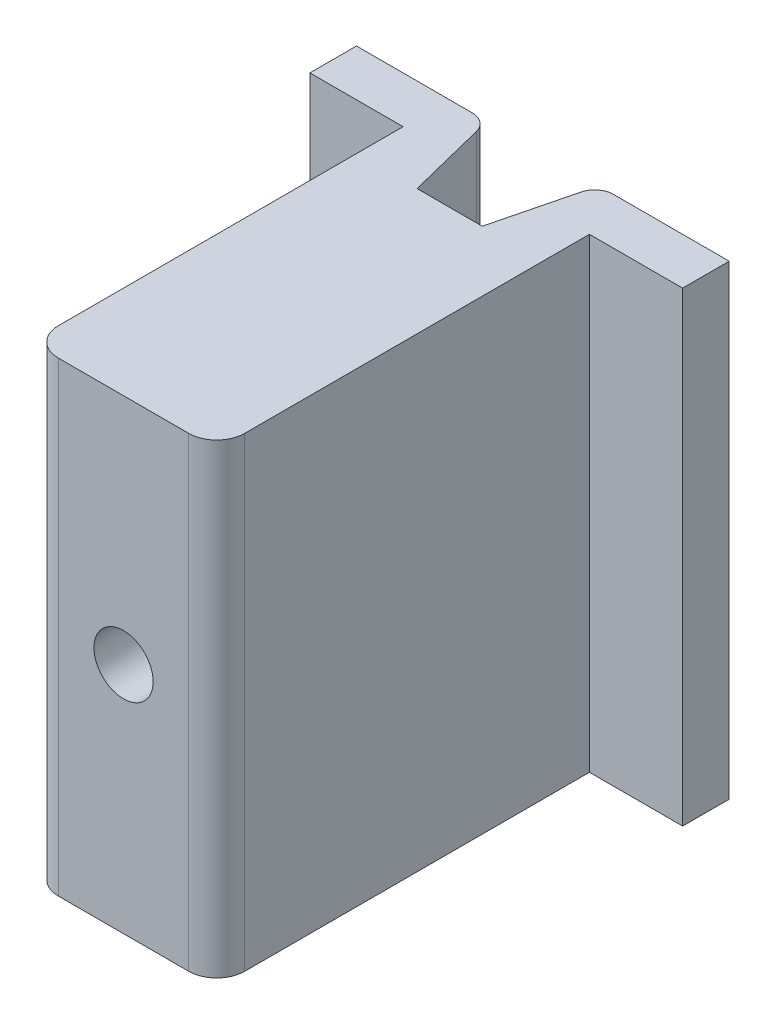
from build123d import *

# Parameters (mm, degrees)
CROQUIS1_W              = 40
CROQUIS1_H              = 50
SALIENTE_EXTRUIR1_DEPTH = 5
CROQUIS2_W              = 20
CROQUIS2_H              = 50
SALIENTE_EXTRUIR2_DEPTH = 40
CORTAR_EXTRUIR1_REACH   = 72.178
REDONDEO1_R             = 2
CORTAR_EXTRUIR2_REACH   = 57.227
CROQUIS4_R              = 3.175
REDONDEO2_R             = 3


with BuildPart() as part:
    # Croquis1 → Saliente-Extruir1 (new body)
    with BuildSketch(Plane.XY):
        Rectangle(CROQUIS1_W, CROQUIS1_H)
    extrude(amount=SALIENTE_EXTRUIR1_DEPTH)

    # Croquis2 → Saliente-Extruir2 (add)
    with BuildSketch(Plane.XY.offset(5)):
        Rectangle(CROQUIS2_W, CROQUIS2_H)
    extrude(amount=SALIENTE_EXTRUIR2_DEPTH)

    # Croquis3 → Cortar-Extruir1 (cut, up to next)
    with BuildSketch(Plane(origin=(0, 25, 0), x_dir=(1, 0, 0), z_dir=(0, 1, 0)), mode=Mode.PRIVATE) as cortar_extruir1_sk1:
        Polygon((-6, 0), (-3.5, -10), (3.5, -10), (6, 0), align=None)
    cortar_extruir1_tool1 = extrude(cortar_extruir1_sk1.sketch, amount=-CORTAR_EXTRUIR1_REACH, mode=Mode.PRIVATE) & part.part
    add(cortar_extruir1_tool1.solids().sort_by_distance((0, 25, 4.561404))[0], mode=Mode.SUBTRACT)

    # Redondeo1
    redondeo1_edges = [part.edges().sort_by_distance(p)[0] for p in [
        (-6, 0, 0),
        (6, 0, 0),
    ]]
    fillet(redondeo1_edges, radius=REDONDEO1_R)

    # Croquis4 → Cortar-Extruir2 (cut, up to next)
    with BuildSketch(Plane.XY.offset(45), mode=Mode.PRIVATE) as cortar_extruir2_sk1:
        Circle(CROQUIS4_R)
    cortar_extruir2_tool1 = extrude(cortar_extruir2_sk1.sketch, amount=-CORTAR_EXTRUIR2_REACH, mode=Mode.PRIVATE) & part.part
    add(cortar_extruir2_tool1.solids().sort_by_distance((0, 0, 45))[0], mode=Mode.SUBTRACT)

    # Redondeo2
    redondeo2_edges = [part.edges().sort_by_distance(p)[0] for p in [
        (10, 0, 45),
        (-10, 0, 45),
    ]]
    fillet(redondeo2_edges, radius=REDONDEO2_R)


solid = part.part
